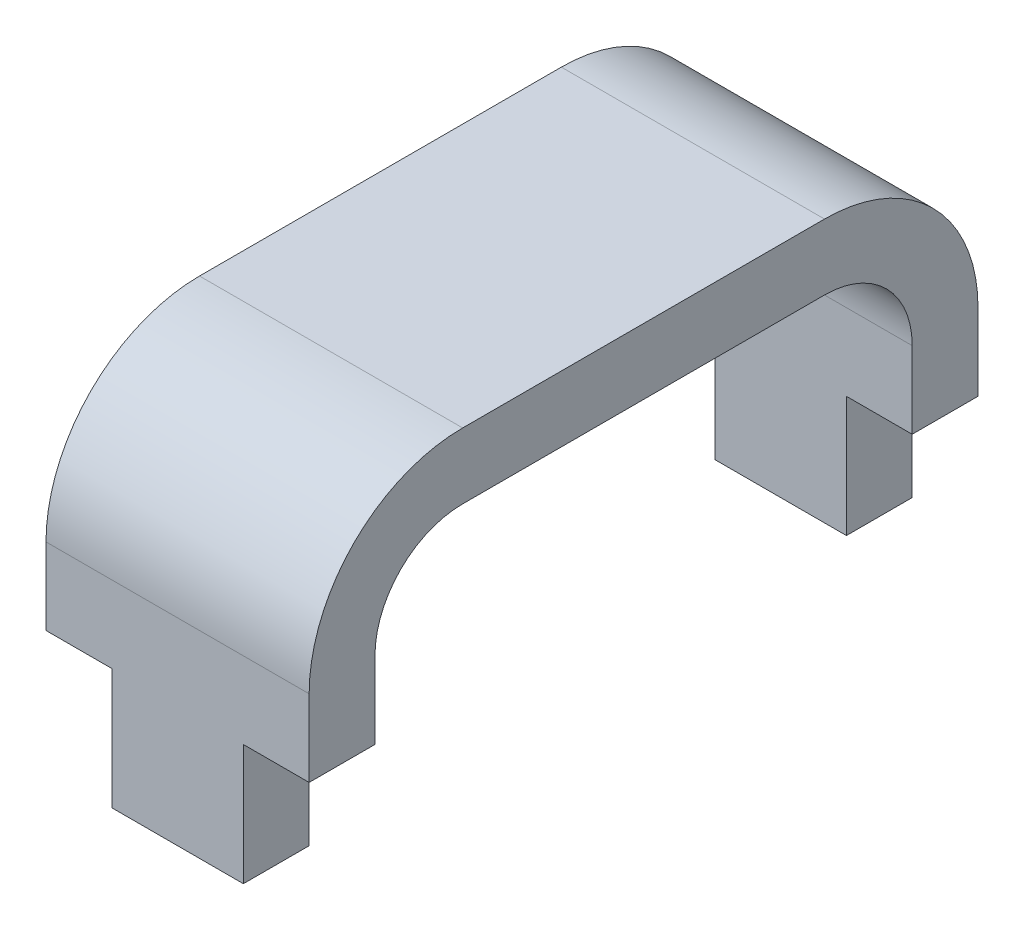
from build123d import *

# Parameters (mm, degrees)
BOSS_EXTRUDE1_DEPTH = 12
SKETCH5_W           = 3
SKETCH5_H           = 5.5
CUT_EXTRUDE1_DEPTH  = 52


with BuildPart() as part:
    # Sketch4 → Boss-Extrude1 (new body)
    with BuildSketch(Plane(origin=(0, 0, 0), x_dir=(0, 0, -1), z_dir=(1, 0, 0))):
        with BuildLine():
            Line((-13.310160428, -12.59959893), (-13.310160428, -3.59959893))
            ThreePointArc((-13.310160428, -3.59959893), (-12.138587553, -0.771171806), (-9.310160428, 0.40040107))
            Line((-9.310160428, 0.40040107), (7.189839572, 0.40040107))
            ThreePointArc((7.189839572, 0.40040107), (10.018266697, -0.771171806), (11.189839572, -3.59959893))
            Line((11.189839572, -3.59959893), (11.189839572, -12.59959893))
            Line((11.189839572, -12.59959893), (14.189839572, -12.59959893))
            Line((14.189839572, -12.59959893), (14.189839572, -3.59959893))
            ThreePointArc((14.189839572, -3.59959893), (12.13958704, 1.350148538), (7.189839572, 3.40040107))
            Line((7.189839572, 3.40040107), (-9.310160428, 3.40040107))
            ThreePointArc((-9.310160428, 3.40040107), (-14.259907896, 1.350148538), (-16.310160428, -3.59959893))
            Line((-16.310160428, -3.59959893), (-16.310160428, -12.59959893))
            Line((-16.310160428, -12.59959893), (-13.310160428, -12.59959893))
        make_face()
    extrude(amount=BOSS_EXTRUDE1_DEPTH)

    # Sketch5 → Cut-Extrude1 (cut)
    with BuildSketch(Plane.XY.offset(16.310160428)):
        with Locations((1.5, -9.84959893)):
            Rectangle(SKETCH5_W, SKETCH5_H)
        with Locations((10.5, -9.84959893)):
            Rectangle(SKETCH5_W, SKETCH5_H)
    extrude(amount=-CUT_EXTRUDE1_DEPTH, mode=Mode.SUBTRACT)


solid = part.part
